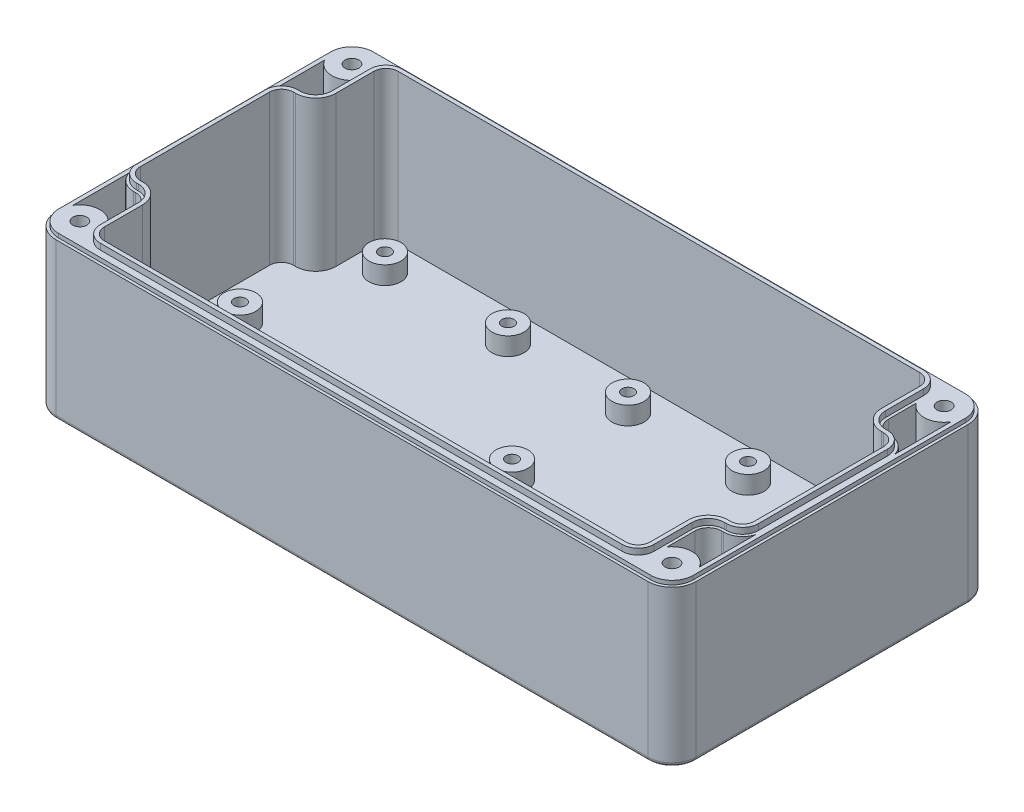
from build123d import *

# Parameters (mm, degrees)
EXTRUDE_1_DEPTH       = 40
CUT_EXTRUDE_START     = 4
CUT_EXTRUDE_1_DEPTH   = 36
CUT_EXTRUDE_START_2   = 2.5
CUT_EXTRUDE_2_DEPTH   = 37.5
MIRROR_START          = 2.5
MIRROR_2_COPY_1_DEPTH = 37.5
EXTRUDE_START         = 40
EXTRUDE_1_2_DEPTH     = 1.5
SKETCH_6_R            = 3.75
CUT_EXTRUDE_3_DEPTH   = 32
SKETCH_7_R            = 1.75
CUT_EXTRUDE_4_DEPTH   = 40
FILLET_1_R            = 1
SKETCH_8_R            = 2.1
CUT_EXTRUDE_5_DEPTH   = 2.5
CUT_EXTRUDE_START_3   = 39
CUT_EXTRUDE_1_2_DEPTH = 1
SKETCH_10_R           = 4
SKETCH_10_R_2         = 1.5
EXTRUDE_2_DEPTH       = 8.5


with BuildPart() as part:
    # Эскиз1 → Extrude 1 (new body)
    with BuildSketch(Plane(origin=(0, 0, 0), x_dir=(1, 0, 0), z_dir=(0, 1, 0))):
        with BuildLine():
            Line((-74, 40), (74, 40))
            ThreePointArc((74, 40), (78.242640687, 38.242640687), (80, 34))
            Line((80, 34), (80, -34))
            ThreePointArc((80, -34), (78.242640687, -38.242640687), (74, -40))
            Line((74, -40), (-74, -40))
            ThreePointArc((-74, -40), (-78.242640687, -38.242640687), (-80, -34))
            Line((-80, -34), (-80, 34))
            ThreePointArc((-80, 34), (-78.242640687, 38.242640687), (-74, 40))
        make_face()
    extrude(amount=EXTRUDE_1_DEPTH)

    # Эскиз2 → Cut-Extrude 1 (cut)
    with BuildSketch(Plane(origin=(0, 0, 0), x_dir=(1, 0, 0), z_dir=(0, 1, 0)).offset(CUT_EXTRUDE_START)):
        with BuildLine():
            Line((-68.2, 33.7), (-68.2, 24.15))
            ThreePointArc((-68.2, 24.15), (-69.664466094, 20.614466094), (-73.2, 19.15))
            Line((-73.2, 19.15), (-73.75, 19.15))
            ThreePointArc((-73.75, 19.15), (-75.871320344, 18.271320344), (-76.75, 16.15))
            Line((-76.75, 16.15), (-76.75, -16.15))
            ThreePointArc((-76.75, -16.15), (-75.871320344, -18.271320344), (-73.75, -19.15))
            Line((-73.75, -19.15), (-73.2, -19.15))
            ThreePointArc((-73.2, -19.15), (-69.664466094, -20.614466094), (-68.2, -24.15))
            Line((-68.2, -24.15), (-68.2, -33.7))
            ThreePointArc((-68.2, -33.7), (-67.321320344, -35.821320344), (-65.2, -36.7))
            Line((-65.2, -36.7), (65.2, -36.7))
            ThreePointArc((65.2, -36.7), (67.321320344, -35.821320344), (68.2, -33.7))
            Line((68.2, -33.7), (68.2, -24.15))
            ThreePointArc((68.2, -24.15), (69.664466094, -20.614466094), (73.2, -19.15))
            Line((73.2, -19.15), (73.75, -19.15))
            ThreePointArc((73.75, -19.15), (75.871320344, -18.271320344), (76.75, -16.15))
            Line((76.75, -16.15), (76.75, 16.15))
            ThreePointArc((76.75, 16.15), (75.871320344, 18.271320344), (73.75, 19.15))
            Line((73.75, 19.15), (73.2, 19.15))
            ThreePointArc((73.2, 19.15), (69.664466094, 20.614466094), (68.2, 24.15))
            Line((68.2, 24.15), (68.2, 33.7))
            ThreePointArc((68.2, 33.7), (67.321320344, 35.821320344), (65.2, 36.7))
            Line((65.2, 36.7), (-65.2, 36.7))
            ThreePointArc((-65.2, 36.7), (-67.321320344, 35.821320344), (-68.2, 33.7))
        make_face()
    extrude(amount=CUT_EXTRUDE_1_DEPTH, mode=Mode.SUBTRACT)

    # Эскиз3 → Вырез-Вытянуть2 (cut)
    with BuildSketch(Plane(origin=(0, 0, 0), x_dir=(1, 0, 0), z_dir=(0, 1, 0)).offset(CUT_EXTRUDE_START_2)):
        with BuildLine():
            ThreePointArc((-69.9, 31.138182396), (-74.184604668, 29.00340905), (-78.3, 31.448529836))
            Line((-78.3, 31.448529836), (-78.3, 17.327921899))
            ThreePointArc((-78.3, 17.327921899), (-76.62695734, 19.866600121), (-73.75, 20.85))
            Line((-73.75, 20.85), (-73.2, 20.85))
            ThreePointArc((-73.2, 20.85), (-70.866547622, 21.816547622), (-69.9, 24.15))
            Line((-69.9, 24.15), (-69.9, 31.138182396))
        make_face()
    cut_extrude_2 = extrude(amount=CUT_EXTRUDE_2_DEPTH, mode=Mode.SUBTRACT)

    # Зеркальное отражение1: Вырез-Вытянуть2 across plane
    add(cut_extrude_2.mirror(Plane.XY), mode=Mode.SUBTRACT)

    # Зеркальное отражение2: Вырез-Вытянуть2 across plane
    add(cut_extrude_2.mirror(Plane(origin=(0, 0, 0), x_dir=(0, 0, 1), z_dir=(1, 0, 0))), mode=Mode.SUBTRACT)

    # Зеркальное отражение2 copy 1 sketch → Зеркальное отражение2 copy 1 (cut)
    with BuildSketch(Plane(origin=(0, 0, 0), x_dir=(-1, 0, 0), z_dir=(0, 1, 0)).offset(MIRROR_START)):
        with BuildLine():
            ThreePointArc((-69.9, 31.138182396), (-74.184604668, 29.00340905), (-78.3, 31.448529836))
            Line((-78.3, 31.448529836), (-78.3, 17.327921899))
            ThreePointArc((-78.3, 17.327921899), (-76.62695734, 19.866600121), (-73.75, 20.85))
            Line((-73.75, 20.85), (-73.2, 20.85))
            ThreePointArc((-73.2, 20.85), (-70.866547622, 21.816547622), (-69.9, 24.15))
            Line((-69.9, 24.15), (-69.9, 31.138182396))
        make_face()
    extrude(amount=MIRROR_2_COPY_1_DEPTH, mode=Mode.SUBTRACT)

    # Эскиз2<2> → Extrude 1 2 (add)
    with BuildSketch(Plane(origin=(0, 0, 0), x_dir=(1, 0, 0), z_dir=(0, 1, 0)).offset(EXTRUDE_START)):
        with BuildLine():
            Line((-69.2, 33.7), (-69.2, 24.15))
            ThreePointArc((-69.2, 24.15), (-70.371572875, 21.321572875), (-73.2, 20.15))
            Line((-73.2, 20.15), (-73.75, 20.15))
            ThreePointArc((-73.75, 20.15), (-76.578427125, 18.978427125), (-77.75, 16.15))
            Line((-77.75, 16.15), (-77.75, -16.15))
            ThreePointArc((-77.75, -16.15), (-76.578427125, -18.978427125), (-73.75, -20.15))
            Line((-73.75, -20.15), (-73.2, -20.15))
            ThreePointArc((-73.2, -20.15), (-70.371572875, -21.321572875), (-69.2, -24.15))
            Line((-69.2, -24.15), (-69.2, -33.7))
            ThreePointArc((-69.2, -33.7), (-68.028427125, -36.528427125), (-65.2, -37.7))
            Line((-65.2, -37.7), (65.2, -37.7))
            ThreePointArc((65.2, -37.7), (68.028427125, -36.528427125), (69.2, -33.7))
            Line((69.2, -33.7), (69.2, -24.15))
            ThreePointArc((69.2, -24.15), (70.371572875, -21.321572875), (73.2, -20.15))
            Line((73.2, -20.15), (73.75, -20.15))
            ThreePointArc((73.75, -20.15), (76.578427125, -18.978427125), (77.75, -16.15))
            Line((77.75, -16.15), (77.75, 16.15))
            ThreePointArc((77.75, 16.15), (76.578427125, 18.978427125), (73.75, 20.15))
            Line((73.75, 20.15), (73.2, 20.15))
            ThreePointArc((73.2, 20.15), (70.371572875, 21.321572875), (69.2, 24.15))
            Line((69.2, 24.15), (69.2, 33.7))
            ThreePointArc((69.2, 33.7), (68.028427125, 36.528427125), (65.2, 37.7))
            Line((65.2, 37.7), (-65.2, 37.7))
            ThreePointArc((-65.2, 37.7), (-68.028427125, 36.528427125), (-69.2, 33.7))
        make_face()
        with BuildLine():
            Line((-68.2, 33.7), (-68.2, 24.15))
            ThreePointArc((-68.2, 24.15), (-69.664466094, 20.614466094), (-73.2, 19.15))
            Line((-73.2, 19.15), (-73.75, 19.15))
            ThreePointArc((-73.75, 19.15), (-75.871320344, 18.271320344), (-76.75, 16.15))
            Line((-76.75, 16.15), (-76.75, -16.15))
            ThreePointArc((-76.75, -16.15), (-75.871320344, -18.271320344), (-73.75, -19.15))
            Line((-73.75, -19.15), (-73.2, -19.15))
            ThreePointArc((-73.2, -19.15), (-69.664466094, -20.614466094), (-68.2, -24.15))
            Line((-68.2, -24.15), (-68.2, -33.7))
            ThreePointArc((-68.2, -33.7), (-67.321320344, -35.821320344), (-65.2, -36.7))
            Line((-65.2, -36.7), (65.2, -36.7))
            ThreePointArc((65.2, -36.7), (67.321320344, -35.821320344), (68.2, -33.7))
            Line((68.2, -33.7), (68.2, -24.15))
            ThreePointArc((68.2, -24.15), (69.664466094, -20.614466094), (73.2, -19.15))
            Line((73.2, -19.15), (73.75, -19.15))
            ThreePointArc((73.75, -19.15), (75.871320344, -18.271320344), (76.75, -16.15))
            Line((76.75, -16.15), (76.75, 16.15))
            ThreePointArc((76.75, 16.15), (75.871320344, 18.271320344), (73.75, 19.15))
            Line((73.75, 19.15), (73.2, 19.15))
            ThreePointArc((73.2, 19.15), (69.664466094, 20.614466094), (68.2, 24.15))
            Line((68.2, 24.15), (68.2, 33.7))
            ThreePointArc((68.2, 33.7), (67.321320344, 35.821320344), (65.2, 36.7))
            Line((65.2, 36.7), (-65.2, 36.7))
            ThreePointArc((-65.2, 36.7), (-67.321320344, 35.821320344), (-68.2, 33.7))
        make_face(mode=Mode.SUBTRACT)
    extrude(amount=EXTRUDE_1_2_DEPTH)

    # Эскиз6 → Вырез-Вытянуть3 (cut)
    with BuildSketch(Plane(origin=(0, 0, 0), x_dir=(1, 0, 0), z_dir=(0, 1, 0))):
        with Locations(Location((-74, 34, 0), (0, 0, 270))):
            Circle(SKETCH_6_R)
        with Locations(Location((-74, -34, 0), (0, 0, 270))):
            Circle(SKETCH_6_R)
        with Locations(Location((74, -34, 0), (0, 0, 270))):
            Circle(SKETCH_6_R)
        with Locations(Location((74, 34, 0), (0, 0, 270))):
            Circle(SKETCH_6_R)
    extrude(amount=CUT_EXTRUDE_3_DEPTH, mode=Mode.SUBTRACT)

    # Эскиз7 → Вырез-Вытянуть4 (cut)
    with BuildSketch(Plane(origin=(0, 0, 0), x_dir=(1, 0, 0), z_dir=(0, 1, 0))):
        with Locations(Location((-74, 34, 0), (0, 0, 90))):
            Circle(SKETCH_7_R)
        with Locations(Location((-74, -34, 0), (0, 0, 90))):
            Circle(SKETCH_7_R)
        with Locations(Location((74, -34, 0), (0, 0, 90))):
            Circle(SKETCH_7_R)
        with Locations(Location((74, 34, 0), (0, 0, 90))):
            Circle(SKETCH_7_R)
    extrude(amount=CUT_EXTRUDE_4_DEPTH, mode=Mode.SUBTRACT)

    # Скругление1
    fillet_1_edges = [part.edges().sort_by_distance(p)[0] for p in [
        (0, 0, -40),
        (78.242640687, 0, -38.242640687),
        (80, 0, 0),
        (78.242640687, 0, 38.242640687),
        (0, 0, 40),
        (-78.242640687, 0, 38.242640687),
        (-80, 0, 0),
        (-78.242640687, 0, -38.242640687),
    ]]
    fillet(fillet_1_edges, radius=FILLET_1_R)

    # Эскиз8 → Вырез-Вытянуть5 (cut)
    with BuildSketch(Plane(origin=(0, 0, 0), x_dir=(1, 0, 0), z_dir=(0, 1, 0))):
        with Locations(Location((-74.15, 25.1, 0), (0, 0, 270))):
            Circle(SKETCH_8_R)
        with Locations(Location((-74.15, -25.1, 0), (0, 0, 270))):
            Circle(SKETCH_8_R)
        with Locations(Location((74.15, -25.1, 0), (0, 0, 270))):
            Circle(SKETCH_8_R)
        with Locations(Location((74.15, 25.1, 0), (0, 0, 270))):
            Circle(SKETCH_8_R)
    extrude(amount=CUT_EXTRUDE_5_DEPTH, mode=Mode.SUBTRACT)

    # Эскиз1<2> → Cut-Extrude 1 2 (cut)
    with BuildSketch(Plane(origin=(0, 0, 0), x_dir=(1, 0, 0), z_dir=(0, 1, 0)).offset(CUT_EXTRUDE_START_3)):
        with BuildLine():
            Line((-74, 40), (74, 40))
            ThreePointArc((74, 40), (78.242640687, 38.242640687), (80, 34))
            Line((80, 34), (80, -34))
            ThreePointArc((80, -34), (78.242640687, -38.242640687), (74, -40))
            Line((74, -40), (-74, -40))
            ThreePointArc((-74, -40), (-78.242640687, -38.242640687), (-80, -34))
            Line((-80, -34), (-80, 34))
            ThreePointArc((-80, 34), (-78.242640687, 38.242640687), (-74, 40))
        make_face()
        with BuildLine():
            Line((-74, 39.3), (74, 39.3))
            ThreePointArc((74, 39.3), (77.74766594, 37.74766594), (79.3, 34))
            Line((79.3, 34), (79.3, -34))
            ThreePointArc((79.3, -34), (77.74766594, -37.74766594), (74, -39.3))
            Line((74, -39.3), (-74, -39.3))
            ThreePointArc((-74, -39.3), (-77.74766594, -37.74766594), (-79.3, -34))
            Line((-79.3, -34), (-79.3, 34))
            ThreePointArc((-79.3, 34), (-77.74766594, 37.74766594), (-74, 39.3))
        make_face(mode=Mode.SUBTRACT)
    extrude(amount=CUT_EXTRUDE_1_2_DEPTH, mode=Mode.SUBTRACT)

    # Эскиз10 → Бобышка-Вытянуть2 (add)
    with BuildSketch(Plane(origin=(0, 0, 0), x_dir=(1, 0, 0), z_dir=(0, 1, 0))):
        with Locations(Location((-60.75, 29, 0), (0, 0, 270))):
            Circle(SKETCH_10_R)
        with Locations(Location((-60.75, 29, 0), (0, 0, 270))):
            Circle(SKETCH_10_R_2, mode=Mode.SUBTRACT)
    extrude_2 = extrude(amount=EXTRUDE_2_DEPTH)

    # Эскиз-Массив1: Бобышка-Вытянуть2 at 12 more places
    with Locations((60.75, 0, 0), (30.75, 0, 0), (60.75, 0, 29), (-7.25, 0, 29), (128.75, 0, 29), (90.75, 0, 0), (121.5, 0, 0), (121.5, 0, 58), (90.75, 0, 58), (30.75, 0, 58), (60.75, 0, 58), (0, 0, 58)):
        add(extrude_2)


solid = part.part
